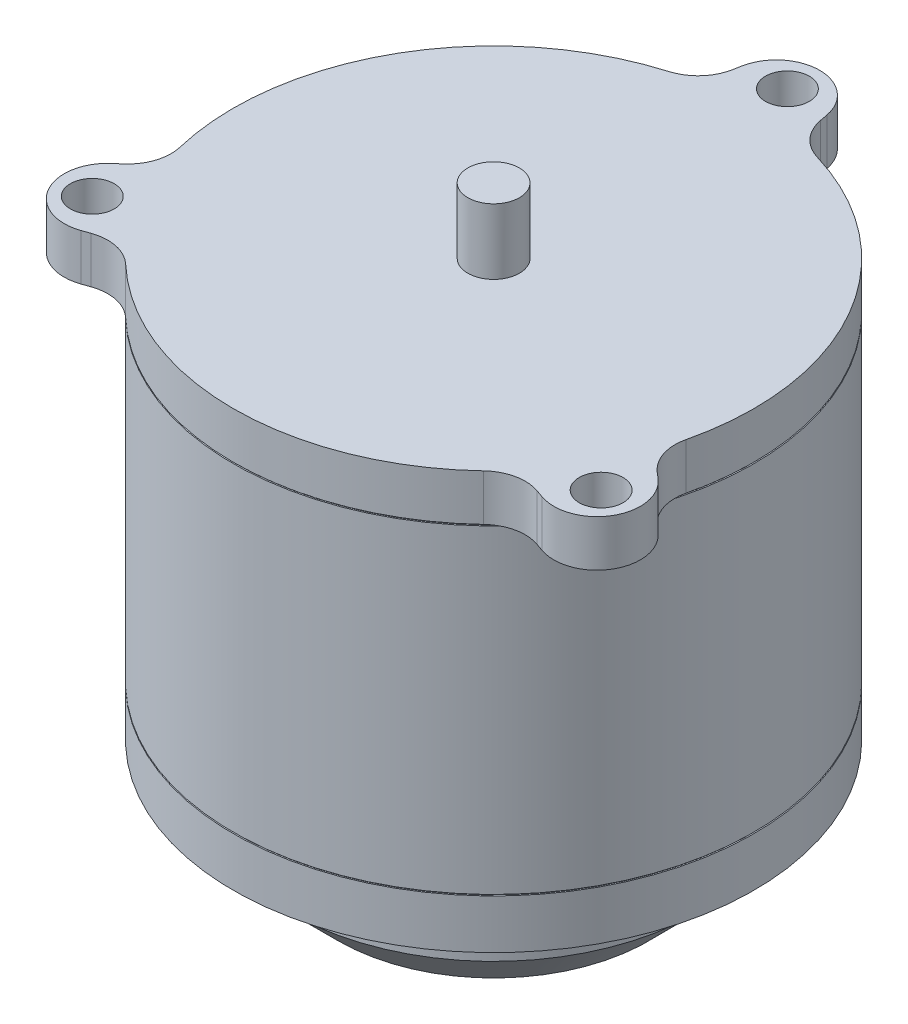
from build123d import *

# Parameters (mm, degrees)
BOSS_EXTRUDE1_START = 9
SKETCH3_R           = 4.25
BOSS_EXTRUDE1_DEPTH = 9
CIRPATTERN1_COUNT   = 3
SKETCH4_R           = 5
BOSS_EXTRUDE2_DEPTH = 12.7


with BuildPart() as part:
    # Sketch1 → Revolve1 (revolve)
    with BuildSketch(Plane.XY):
        Polygon((0, 78.640438678), (0, -19.887292524), (16, -19.887292524), (16, -11.949792524), (30.1625, -11.949792524), (39.6875, -2.424792524), (39.6875, 6.694938678), (50.5, 6.694938678), (50.5, 16.219938678), (50.246, 16.219938678), (50.246, 16.473938678), (50.5, 16.473938678), (50.5, 78.386438678), (50.246, 78.386438678), (50.246, 78.640438678), align=None)
    revolve(axis=Axis((0, -28.529868613, 0), (0, 1, 0)))

    # Sketch3 → Boss-Extrude1 (add)
    with BuildSketch(Plane(origin=(0, 78.640438678, 0), x_dir=(1, 0, 0), z_dir=(0, 1, 0)).offset(BOSS_EXTRUDE1_START)):
        with BuildLine():
            Line((-8.246317561, 56.400339065), (-8.527789484, 54.9019935))
            ThreePointArc((-8.527789484, 54.9019935), (-10.543132136, 50.831813425), (-14.384179724, 48.408112685))
            ThreePointArc((-14.384179724, 48.408112685), (0, -50.5), (14.384179724, 48.408112685))
            ThreePointArc((14.384179724, 48.408112685), (10.543132136, 50.831813425), (8.527789484, 54.9019935))
            Line((8.527789484, 54.9019935), (8.246317561, 56.400339065))
            ThreePointArc((8.246317561, 56.400339065), (0, 63.241786356), (-8.246317561, 56.400339065))
        make_face()
        with Locations((0, 57)):
            Circle(SKETCH3_R, mode=Mode.SUBTRACT)
    boss_extrude1 = extrude(amount=-BOSS_EXTRUDE1_DEPTH)

    # CirPattern1: Boss-Extrude1 ×3 about axis
    cirpattern1_axis = Axis((0, 87.640438678, 0), (0, -1, 0))
    for i in range(1, CIRPATTERN1_COUNT):
        add(boss_extrude1.rotate(cirpattern1_axis, i * 360 / CIRPATTERN1_COUNT))

    # Sketch4 → Boss-Extrude2 (add)
    with BuildSketch(Plane(origin=(0, 87.640438678, 0), x_dir=(1, 0, 0), z_dir=(0, 1, 0))):
        Circle(SKETCH4_R)
    extrude(amount=BOSS_EXTRUDE2_DEPTH)


solid = part.part
